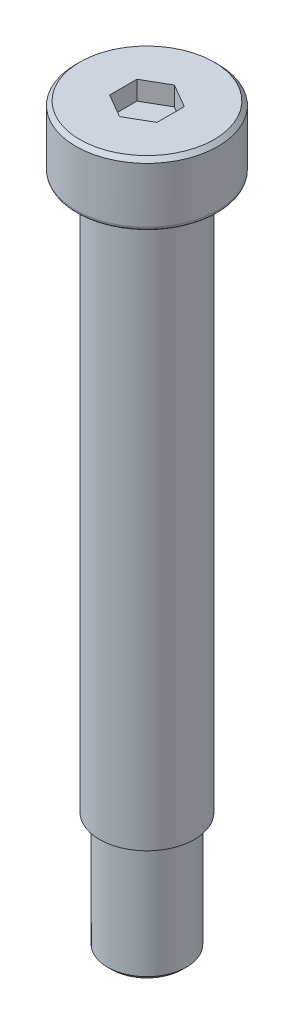
from build123d import *

# Parameters (mm, degrees)
CUT_EXTRUDE1_DEPTH = 2.4
CHAMFER1_SIZE      = 0.5
FILLET1_R          = 0.5
CHAMFER2_SIZE      = 0.5


with BuildPart() as part:
    # Sketch1 → Revolve1 (revolve)
    with BuildSketch(Plane.XY, mode=Mode.PRIVATE) as revolve1_sk:
        Polygon((0, 0), (9, 0), (9, -8), (5.75, -8), (5.75, -8.5), (6, -8.5), (6, -78), (5, -78), (5, -93), (0, -93), align=None)
    revolve(revolve1_sk.sketch.rotate(Axis((0, 5, 0), (0, -1, 0)), 180), axis=Axis((0, 5, 0), (0, -1, 0)))

    # Sketch2 → Cut-Extrude1 (cut)
    with BuildSketch(Plane(origin=(0, 0, 0), x_dir=(1, 0, 0), z_dir=(0, 1, 0))):
        Polygon((0, -3.464101615), (3, -1.732050808), (3, 1.732050808), (0, 3.464101615), (-3, 1.732050808), (-3, -1.732050808), align=None)
    extrude(amount=-CUT_EXTRUDE1_DEPTH, mode=Mode.SUBTRACT)

    # Chamfer1
    chamfer1_edges = [part.edges().sort_by_distance(p)[0] for p in [
        (9, 0, 0),
    ]]
    chamfer(chamfer1_edges, length=CHAMFER1_SIZE)

    # Fillet1
    fillet1_edges = [part.edges().sort_by_distance(p)[0] for p in [
        (9, -8, 0),
    ]]
    fillet(fillet1_edges, radius=FILLET1_R)

    # Chamfer2
    chamfer2_edges = [part.edges().sort_by_distance(p)[0] for p in [
        (5, -93, 0),
    ]]
    chamfer(chamfer2_edges, length=CHAMFER2_SIZE)


solid = part.part
